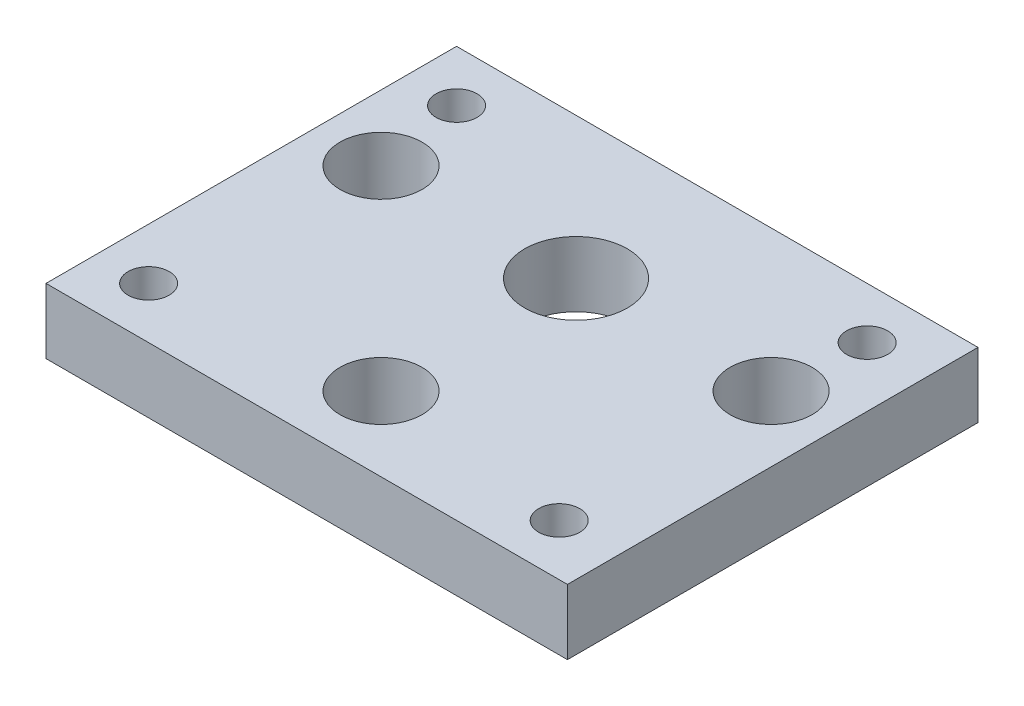
from build123d import *

# Parameters (mm, degrees)
CROQUIS1_W              = 50.8
CROQUIS1_H              = 80
SALIENTE_EXTRUIR1_DEPTH = 6.35
CROQUIS4_R              = 4
CORTAR_EXTRUIR3_DEPTH   = 48.806720239
CROQUIS5_W              = 50.8
CROQUIS5_H              = 12.7
CORTAR_EXTRUIR4_DEPTH   = 48.806720239
CROQUIS6_W              = 50.8
CROQUIS6_H              = 20.526572449
CORTAR_EXTRUIR5_DEPTH   = 10
CROQUIS7_W              = 50.8
CROQUIS7_H              = 6.773427551
CORTAR_EXTRUIR6_DEPTH   = 10
CROQUIS9_R              = 5
CORTAR_EXTRUIR7_DEPTH   = 10
CROQUIS10_R             = 2
CORTAR_EXTRUIR8_DEPTH   = 10


with BuildPart() as part:
    # Croquis1 → Saliente-Extruir1 (new body)
    with BuildSketch(Plane(origin=(0, 0, 0), x_dir=(1, 0, 0), z_dir=(0, 1, 0))):
        Rectangle(CROQUIS1_W, CROQUIS1_H)
    extrude(amount=SALIENTE_EXTRUIR1_DEPTH)

    # Croquis4 → Cortar-Extruir3 (cut, through all)
    with BuildSketch(Plane(origin=(0, 6.35, 0), x_dir=(1, 0, 0), z_dir=(0, 1, 0))):
        with Locations(Location((-19, 19.466091849, 0), (0, 0, 270))):
            Circle(CROQUIS4_R)
        with Locations(Location((19, 19.466091849, 0), (0, 0, 270))):
            Circle(CROQUIS4_R)
        with Locations(Location((0, 0.466091849, 0), (0, 0, 270))):
            Circle(CROQUIS4_R)
    extrude(amount=-CORTAR_EXTRUIR3_DEPTH, mode=Mode.SUBTRACT)

    # Croquis5 → Cortar-Extruir4 (cut, through all)
    with BuildSketch(Plane(origin=(0, 6.35, 0), x_dir=(1, 0, 0), z_dir=(0, 1, 0))):
        with Locations((0, -33.65)):
            Rectangle(CROQUIS5_W, CROQUIS5_H)
    extrude(amount=-CORTAR_EXTRUIR4_DEPTH, mode=Mode.SUBTRACT)

    # Croquis6 → Cortar-Extruir5 (cut)
    with BuildSketch(Plane(origin=(0, 6.35, 0), x_dir=(1, 0, 0), z_dir=(0, 1, 0))):
        with Locations((0, -17.036713776)):
            Rectangle(CROQUIS6_W, CROQUIS6_H)
    extrude(amount=-CORTAR_EXTRUIR5_DEPTH, mode=Mode.SUBTRACT)

    # Croquis7 → Cortar-Extruir6 (cut)
    with BuildSketch(Plane.XZ):
        with Locations((0, -36.613286225)):
            Rectangle(CROQUIS7_W, CROQUIS7_H)
    extrude(amount=-CORTAR_EXTRUIR6_DEPTH, mode=Mode.SUBTRACT)

    # Croquis9 → Cortar-Extruir7 (cut)
    with BuildSketch(Plane.XZ):
        with Locations(Location((0, -19.466091849, 0), (0, 0, 270))):
            Circle(CROQUIS9_R)
    extrude(amount=-CORTAR_EXTRUIR7_DEPTH, mode=Mode.SUBTRACT)

    # Croquis10 → Cortar-Extruir8 (cut)
    with BuildSketch(Plane.XZ):
        with Locations(Location((-20.4, 1.773427551, 0), (0, 0, 270))):
            Circle(CROQUIS10_R)
        with Locations(Location((19.6, 1.773427551, 0), (0, 0, 270))):
            Circle(CROQUIS10_R)
        with Locations(Location((19.6, -28.226572449, 0), (0, 0, 270))):
            Circle(CROQUIS10_R)
        with Locations(Location((-20.4, -28.226572449, 0), (0, 0, 270))):
            Circle(CROQUIS10_R)
    extrude(amount=-CORTAR_EXTRUIR8_DEPTH, mode=Mode.SUBTRACT)


solid = part.part
